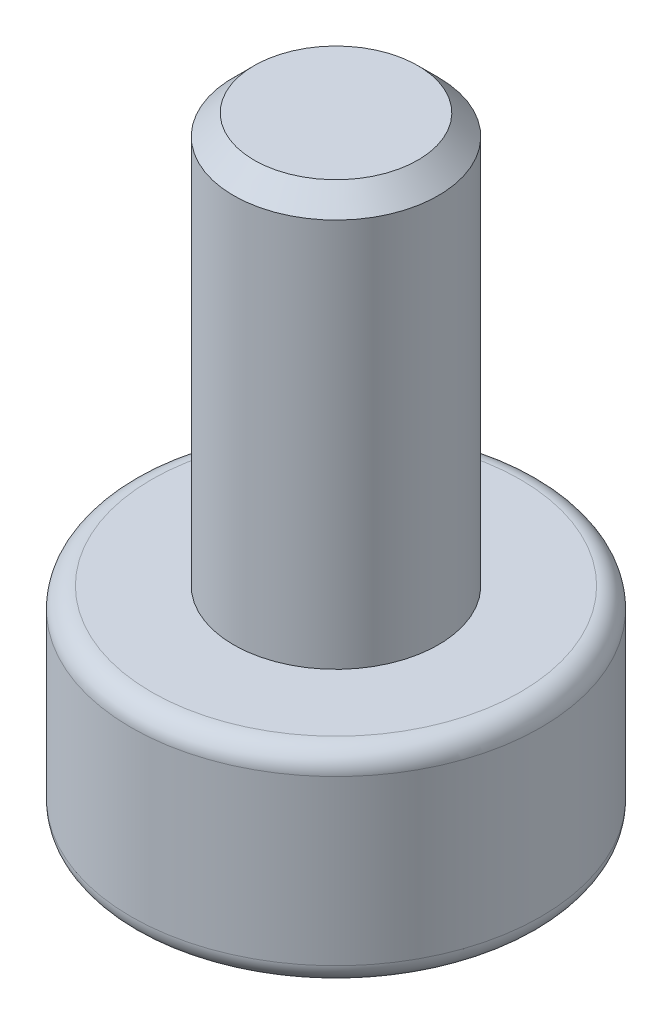
from build123d import *

# Parameters (mm, degrees)
SKETCH_2_R          = 2
EXTRUDE_1_DEPTH     = 2
SKETCH_3_R          = 1
EXTRUDE_2_DEPTH     = 4
FILLET_1_R          = 0.2
SKETCH_4_R          = 0.765
CUT_EXTRUDE_1_DEPTH = 1.52
CHAMFER_1_SIZE      = 0.1
CHAMFER_2_SIZE      = 0.2


with BuildPart() as part:
    # 草图2 → 凸台-拉伸1 (new body)
    with BuildSketch(Plane(origin=(0, 0, 0), x_dir=(1, 0, 0), z_dir=(0, 1, 0))):
        with Locations(Location((0, 0, 0), (0, 0, 270))):
            Circle(SKETCH_2_R)
    extrude(amount=EXTRUDE_1_DEPTH)

    # 草图3 → 凸台-拉伸2 (add)
    with BuildSketch(Plane(origin=(0, 2, 0), x_dir=(1, 0, 0), z_dir=(0, 1, 0))):
        with Locations(Location((0, 0, 0), (0, 0, 270))):
            Circle(SKETCH_3_R)
    extrude(amount=EXTRUDE_2_DEPTH)

    # 圆角1
    fillet_1_edges = [part.edges().sort_by_distance(p)[0] for p in [
        (0, 0, -2),
        (0, 2, -2),
    ]]
    fillet(fillet_1_edges, radius=FILLET_1_R)

    # 草图4 → 切除-拉伸1 (cut)
    with BuildSketch(Plane.XZ):
        with Locations(Location((0, 0, 0), (0, 0, 270))):
            Circle(SKETCH_4_R)
    extrude(amount=-CUT_EXTRUDE_1_DEPTH, mode=Mode.SUBTRACT)

    # 倒角1
    chamfer_1_edges = [part.edges().sort_by_distance(p)[0] for p in [
        (0, 0, 0.765),
    ]]
    chamfer(chamfer_1_edges, length=CHAMFER_1_SIZE)

    # 倒角2
    chamfer_2_edges = [part.edges().sort_by_distance(p)[0] for p in [
        (0, 6, -1),
    ]]
    chamfer(chamfer_2_edges, length=CHAMFER_2_SIZE)


solid = part.part
